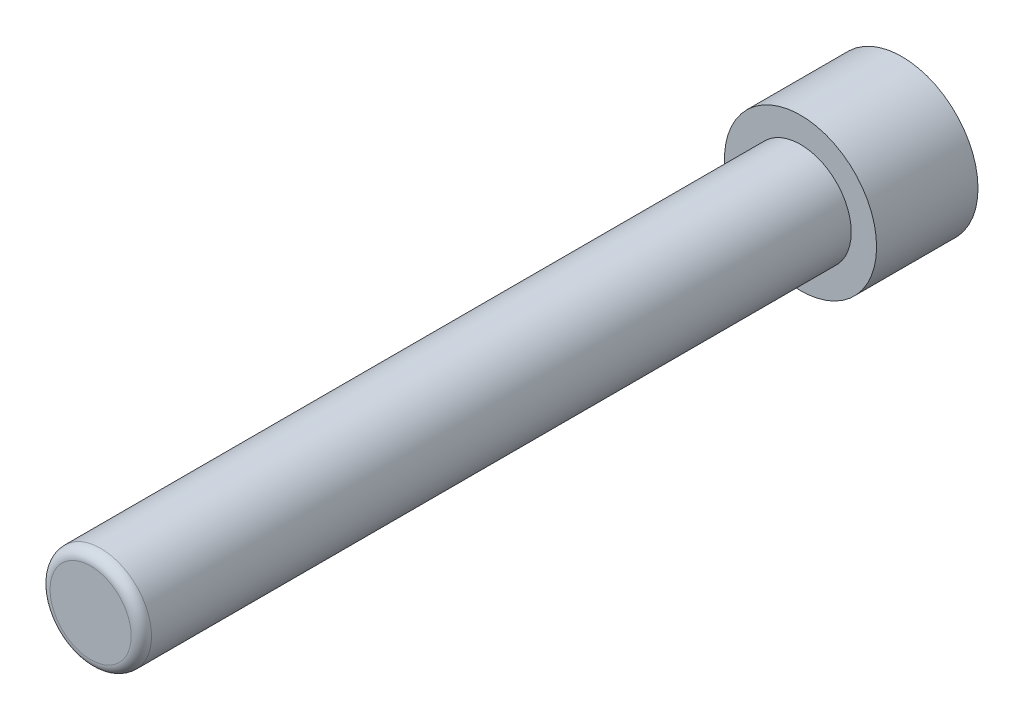
from build123d import *

# Parameters (mm, degrees)
SKETCH1_R      = 19.05
EXTRUDE1_DEPTH = 25.4
SKETCH2_R      = 12.7
EXTRUDE2_DEPTH = 177.8
FILLET1_R      = 2.54


with BuildPart() as part:
    # Sketch1 → Extrude1 (new body)
    with BuildSketch(Plane.XY):
        Circle(SKETCH1_R)
    extrude(amount=EXTRUDE1_DEPTH)

    # Sketch2 → Extrude2 (add)
    with BuildSketch(Plane.XY.offset(25.4)):
        Circle(SKETCH2_R)
    extrude(amount=EXTRUDE2_DEPTH)

    # Fillet1
    fillet1_edges = [part.edges().sort_by_distance(p)[0] for p in [
        (-12.7, 0, 203.2),
    ]]
    fillet(fillet1_edges, radius=FILLET1_R)


solid = part.part
